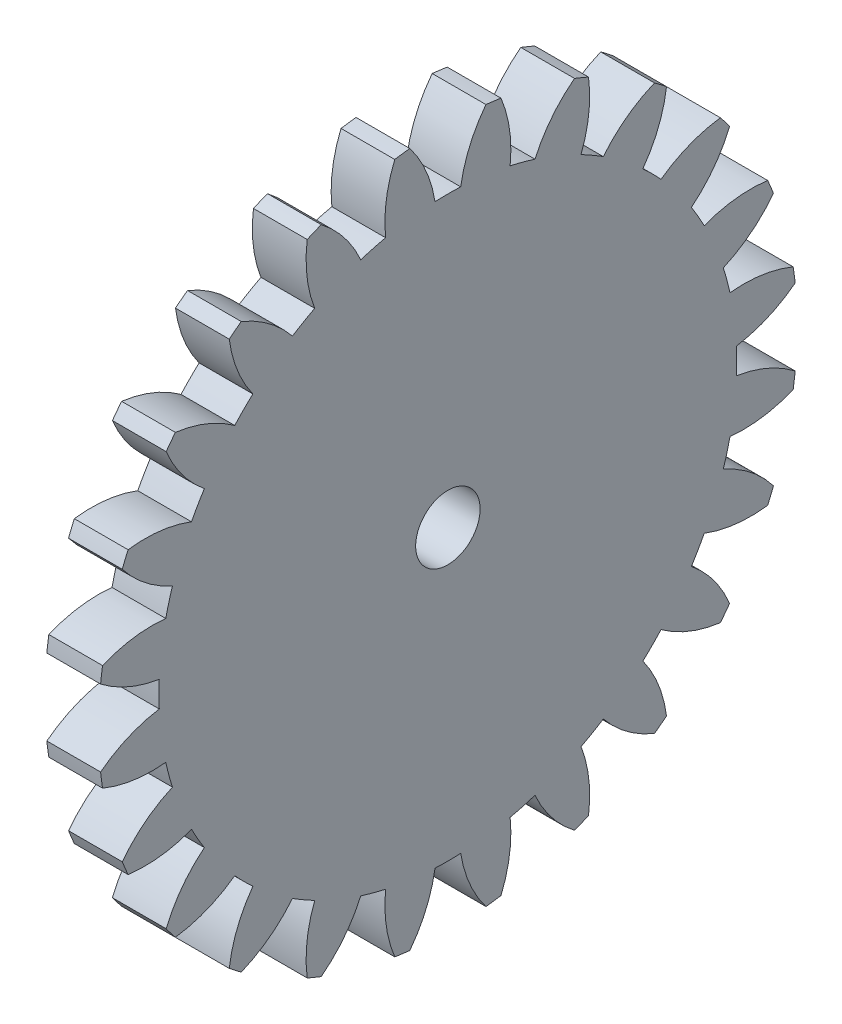
from build123d import *

# Parameters (mm, degrees)
BASPROSKE_W     = 5
BASPROSKE_H     = 32.5
TOOTHCUT_DEPTH  = 47.233105022
TEETHCUTS_COUNT = 24
TEETHCUTS_ANGLE = 345
BORSKE_R        = 3
BORE_DEPTH      = 50.0000508


with BuildPart() as part:
    # BasProSke → Base-Revolve (revolve)
    with BuildSketch(Plane(origin=(0, 0, 0), x_dir=(1, 0, 0), z_dir=(0, 1, 0)), mode=Mode.PRIVATE) as base_revolve_sk:
        with Locations((2.5, 16.25)):
            Rectangle(BASPROSKE_W, BASPROSKE_H)
    revolve(base_revolve_sk.sketch.rotate(Axis((-10, 0, 0), (1, 0, 0)), 180), axis=Axis((-10, 0, 0), (1, 0, 0)))

    # TooCutSke → ToothCut (cut, through all)
    with BuildSketch(Plane(origin=(0, 0, 0), x_dir=(0, 0, -1), z_dir=(1, 0, 0))):
        with BuildLine():
            ThreePointArc((1.196304146, 26.847359877), (0, 26.874), (-1.196304146, 26.847359877))
            ThreePointArc((-1.196304146, 26.847359877), (-2.031613036, 29.738020513), (-3.559760234, 32.33001318))
            ThreePointArc((-3.559760234, 32.33001318), (0, 32.5254), (3.559760234, 32.33001318))
            ThreePointArc((3.559760234, 32.33001318), (2.031613036, 29.738020513), (1.196304146, 26.847359877))
        make_face()
    toothcut = extrude(amount=TOOTHCUT_DEPTH, mode=Mode.SUBTRACT)

    # TeethCuts: ToothCut ×24 about axis
    teethcuts_axis = Axis((-10, 0, 0), (1, 0, 0))
    for i in range(1, TEETHCUTS_COUNT):
        add(toothcut.rotate(teethcuts_axis, i * TEETHCUTS_ANGLE / (TEETHCUTS_COUNT - 1)), mode=Mode.SUBTRACT)

    # BorSke → Bore (cut, symmetric)
    with BuildSketch(Plane(origin=(0, 0, 0), x_dir=(0, 0, -1), z_dir=(1, 0, 0))):
        with Locations(Location((0, 0, 0), (0, 0, 180))):
            Circle(BORSKE_R)
    extrude(amount=BORE_DEPTH, both=True, mode=Mode.SUBTRACT)


solid = part.part
